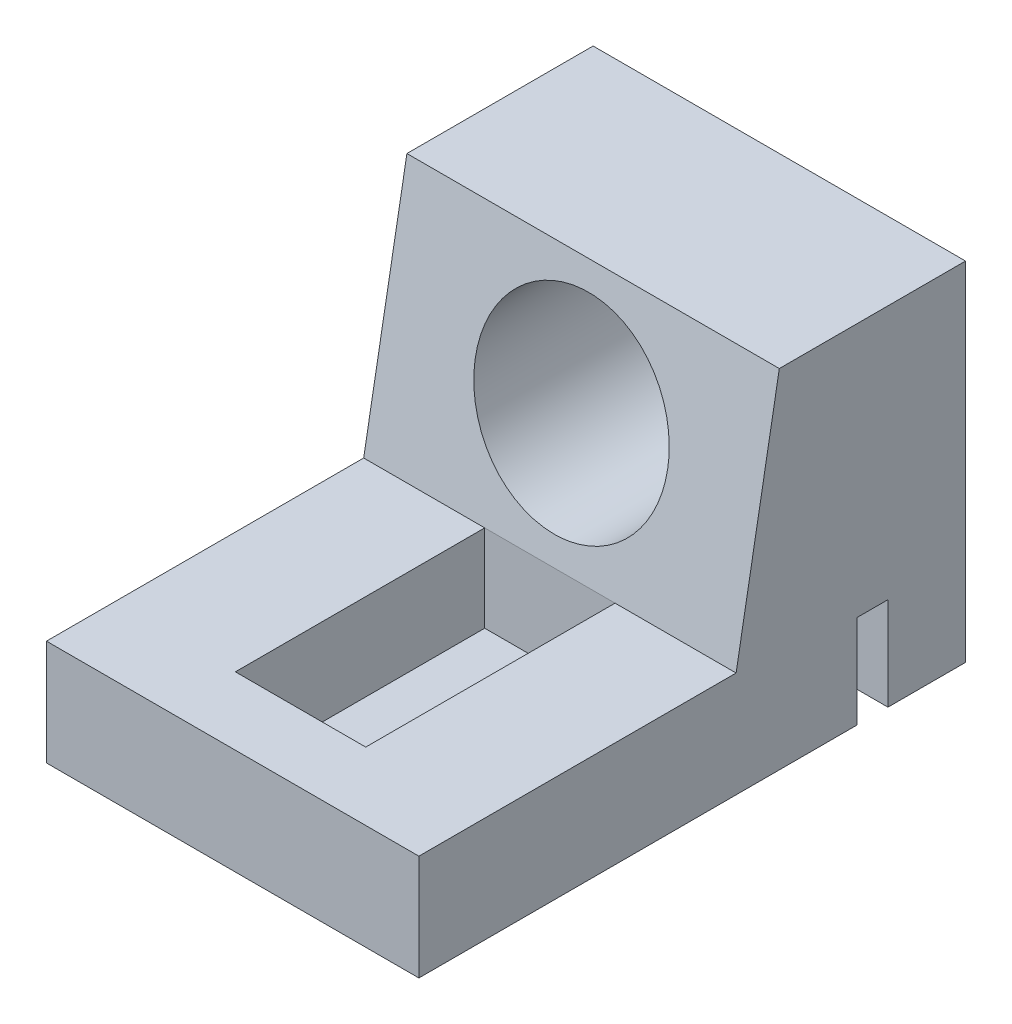
from build123d import *

# Parameters (mm, degrees)
EXTRUDE_1_DEPTH          = 60
CUT_EXTRUDE_1_DEPTH      = 40
CUT_EXTRUDE_1_DEPTH_BACK = 29
SKETCH_4_R               = 15.5
SKETCH_5_W               = 5
SKETCH_5_H               = 30
CUT_EXTRUDE_2_DEPTH      = 83.900874001
SKETCH_7_W               = 60
SKETCH_7_H               = 85.424918669
EXTRUDE_2_DEPTH          = 17
CUT_EXTRUDE_START        = -34.454396
SKETCH_9_W               = 21
SKETCH_9_H               = 40.17
CUT_EXTRUDE_3_DEPTH      = 14
SKETCH_12_W              = 60
SKETCH_12_H              = 16.92976669
CUT_EXTRUDE_4_DEPTH      = 120.781279465
CUT_EXTRUDE_START_2      = -15
SKETCH_14_W              = 60
SKETCH_14_H              = 56
CUT_EXTRUDE_8_DEPTH      = 10


with BuildPart() as part:
    # 스케치3 → 보스-돌출1 (new body)
    with BuildSketch(Plane(origin=(0, 0, 0), x_dir=(0, 0, -1), z_dir=(1, 0, 0))):
        Polygon((-25, -51.454396413), (25, -51.454396413), (15, 4.545603587), (-15, 4.545603587), align=None)
    extrude(amount=EXTRUDE_1_DEPTH)

    # 스케치4 → 컷-돌출1 (cut, two sides: drawn at the far end of the back side and taken through both)
    with BuildSketch(Plane.XY.offset(-CUT_EXTRUDE_1_DEPTH_BACK)):
        with Locations(Location((30, -14.954396413, 0), (0, 0, 90))):
            Circle(SKETCH_4_R)
    extrude(amount=CUT_EXTRUDE_1_DEPTH + CUT_EXTRUDE_1_DEPTH_BACK, mode=Mode.SUBTRACT)

    # 스케치5 → 컷-돌출2 (cut, through all)
    with BuildSketch(Plane(origin=(0, 0, 0), x_dir=(0, 0, -1), z_dir=(1, 0, 0))):
        with Locations((0, -51.454396413)):
            Rectangle(SKETCH_5_W, SKETCH_5_H)
    extrude(amount=CUT_EXTRUDE_2_DEPTH, mode=Mode.SUBTRACT)

    # 스케치7 → 보스-돌출2 (add)
    with BuildSketch(Plane(origin=(0, -51.454396413, 0), x_dir=(-1, 0, 0), z_dir=(0, -1, 0))):
        with Locations((-30, -47.287540666)):
            Rectangle(SKETCH_7_W, SKETCH_7_H)
    extrude(amount=-EXTRUDE_2_DEPTH)

    # 스케치9 → 컷-돌출3 (cut)
    with BuildSketch(Plane(origin=(0, 0, 0), x_dir=(1, 0, 0), z_dir=(0, 1, 0)).offset(CUT_EXTRUDE_START)):
        with Locations((30, -42.049285714)):
            Rectangle(SKETCH_9_W, SKETCH_9_H)
    extrude(amount=-CUT_EXTRUDE_3_DEPTH, mode=Mode.SUBTRACT)

    # 스케치12 → 컷-돌출4 (cut, through all)
    with BuildSketch(Plane(origin=(0, 0, 0), x_dir=(1, 0, 0), z_dir=(0, 1, 0))):
        with Locations((30, -81.535116655)):
            Rectangle(SKETCH_12_W, SKETCH_12_H)
    extrude(amount=-CUT_EXTRUDE_4_DEPTH, mode=Mode.SUBTRACT)

    # 스케치14 → 컷-돌출8 (cut)
    with BuildSketch(Plane.XY.offset(CUT_EXTRUDE_START_2)):
        with Locations((30, -23.454396413)):
            Rectangle(SKETCH_14_W, SKETCH_14_H)
    extrude(amount=-CUT_EXTRUDE_8_DEPTH, mode=Mode.SUBTRACT)


solid = part.part
